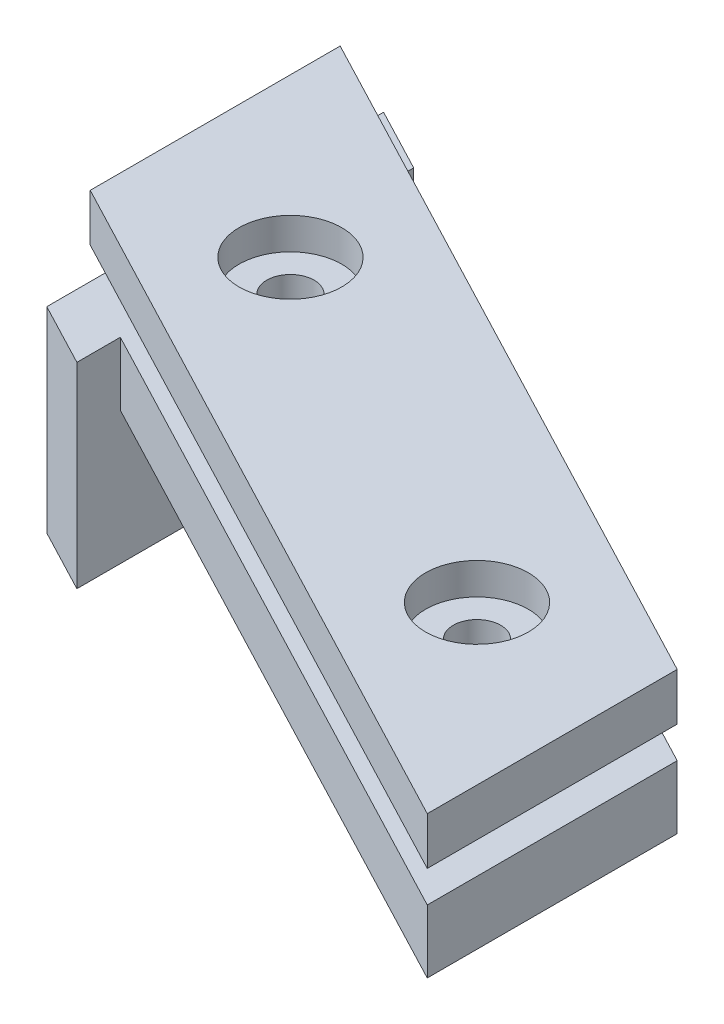
from build123d import *

# Parameters (mm, degrees)
BOSS_EXTRUDE1_DEPTH = 3
SKETCH1_R           = 6
BOSS_EXTRUDE3_DEPTH = 2
SKETCH4_R           = 1.5
CUT_EXTRUDE1_DEPTH  = 44.812962497
SKETCH5_R           = 3.25
CUT_EXTRUDE2_DEPTH  = 2
SKETCH6_R           = 1.5
BOSS_EXTRUDE4_DEPTH = 4
BOSS_EXTRUDE5_DEPTH = 12.4


with BuildPart() as part:
    # Sketch3 → Boss-Extrude1 (new body)
    with BuildSketch(Plane(origin=(0, 0, 0), x_dir=(1, 0, 0), z_dir=(0, 1, 0))):
        Polygon((-10, 13.145588768), (-10, -2.661376867), (34.799193535, -26.145588768), (34.799193535, -10.338623133), align=None)
    extrude(amount=BOSS_EXTRUDE1_DEPTH)

    # Sketch1 → Boss-Extrude3 (add)
    with BuildSketch(Plane(origin=(0, 0, 0), x_dir=(1, 0, 0), z_dir=(0, 1, 0))):
        with Locations(Location((0, 0, 0), (0, 0, 270))):
            Circle(SKETCH1_R)
        with Locations(Location((24.799193535, -13, 0), (0, 0, 270))):
            Circle(SKETCH1_R)
    extrude(amount=-BOSS_EXTRUDE3_DEPTH)

    # Sketch4 → Cut-Extrude1 (cut, through all)
    with BuildSketch(Plane(origin=(0, 3, 0), x_dir=(1, 0, 0), z_dir=(0, 1, 0))):
        with Locations(Location((0, 0, 0), (0, 0, 270))):
            Circle(SKETCH4_R)
        with Locations(Location((24.799193535, -13, 0), (0, 0, 270))):
            Circle(SKETCH4_R)
    extrude(amount=-CUT_EXTRUDE1_DEPTH, mode=Mode.SUBTRACT)

    # Sketch5 → Cut-Extrude2 (cut)
    with BuildSketch(Plane(origin=(0, 3, 0), x_dir=(1, 0, 0), z_dir=(0, 1, 0))):
        with Locations(Location((0, 0, 0), (0, 0, 270))):
            Circle(SKETCH5_R)
        with Locations(Location((24.799193535, -13, 0), (0, 0, 270))):
            Circle(SKETCH5_R)
    extrude(amount=-CUT_EXTRUDE2_DEPTH, mode=Mode.SUBTRACT)


with BuildPart() as body_2:
    # Sketch6 → Boss-Extrude4 (new body)
    with BuildSketch(Plane.XZ.offset(2)):
        Polygon((-10, 2.661376867), (-10, -13.145588768), (34.799193535, 10.338623133), (34.799193535, 26.145588768), align=None)
        with Locations(Location((0, 0, 0), (0, 0, 270))):
            Circle(SKETCH6_R, mode=Mode.SUBTRACT)
        with Locations(Location((24.799193535, 13, 0), (0, 0, 270))):
            Circle(SKETCH6_R, mode=Mode.SUBTRACT)
    extrude(amount=BOSS_EXTRUDE4_DEPTH)

    # Sketch7 → Boss-Extrude5 (add)
    with BuildSketch(Plane(origin=(0, -2, 0), x_dir=(1, 0, 0), z_dir=(0, 1, 0))):
        Polygon((-10, 15.892105951), (-10, -5.407894049), (-6, -7.50473643), (-6, 13.79526357), align=None)
    extrude(amount=-BOSS_EXTRUDE5_DEPTH)


solid = Compound([part.part, body_2.part])
